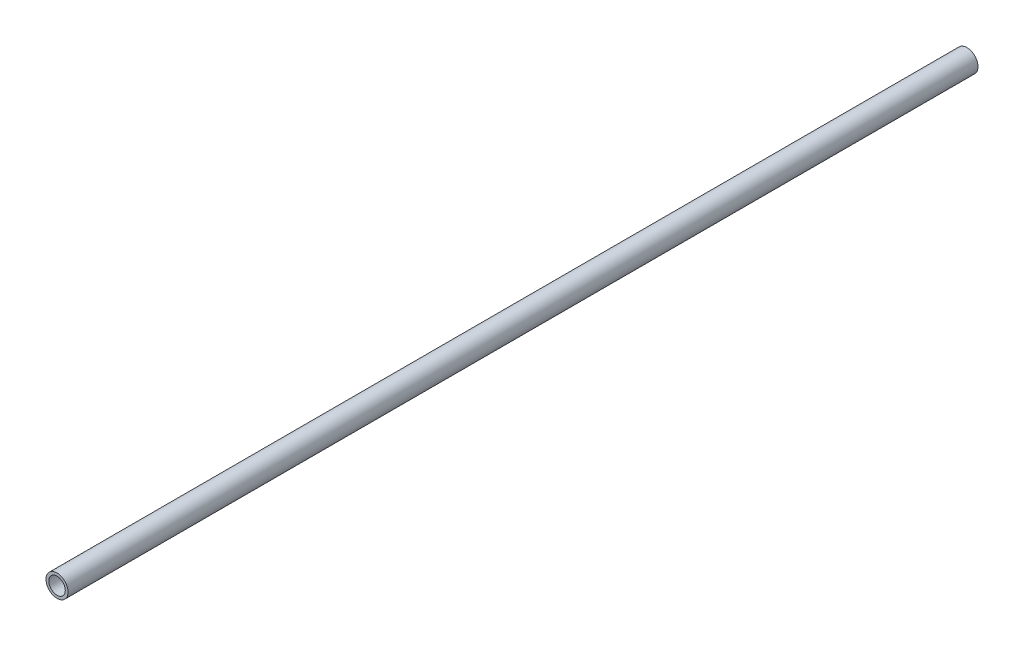
from build123d import *

# Parameters (mm, degrees)
SKETCH_1_R      = 4
SKETCH_1_R_2    = 3
EXTRUDE_1_DEPTH = 330


with BuildPart() as part:
    # 草图1 → 凸台-拉伸1 (new body)
    with BuildSketch(Plane.XY):
        Circle(SKETCH_1_R)
        Circle(SKETCH_1_R_2, mode=Mode.SUBTRACT)
    extrude(amount=EXTRUDE_1_DEPTH)


solid = part.part
